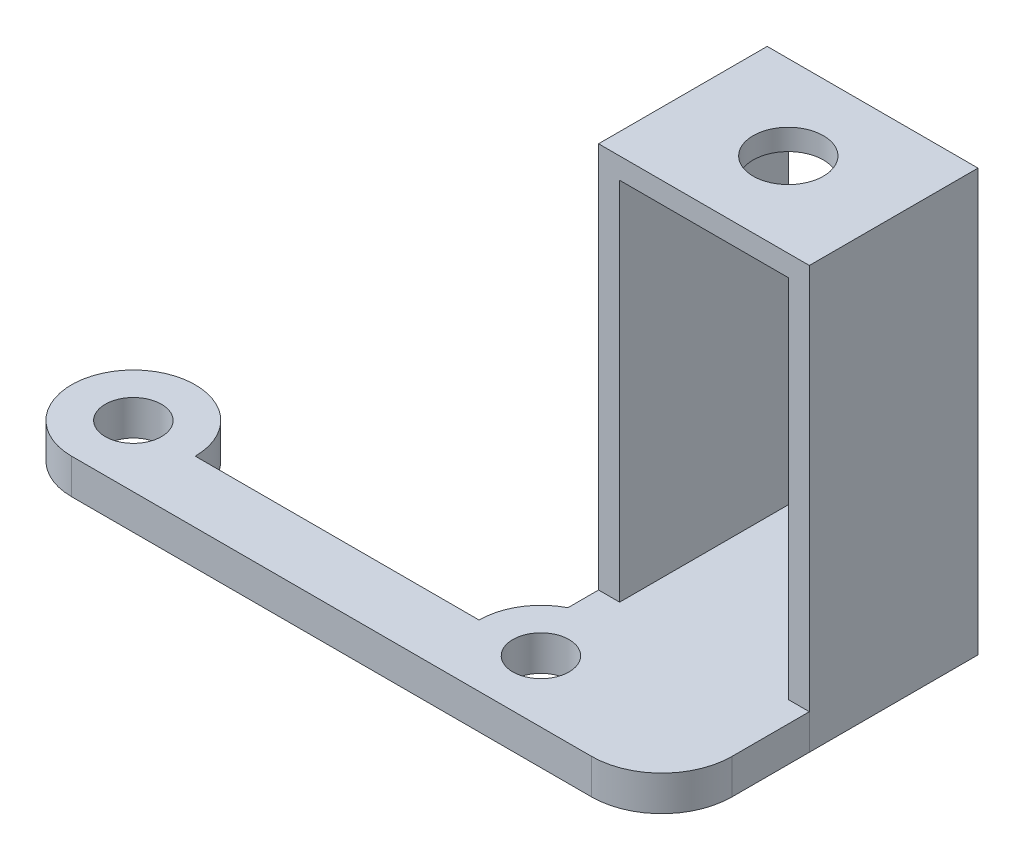
from build123d import *

# Parameters (mm, degrees)
SKETCH_1_R          = 4
EXTRUDE_1_DEPTH     = 5
EXTRUDE_2_DEPTH     = 5
EXTRUDE_3_DEPTH     = 24
SKETCH_6_R          = 5
CUT_EXTRUDE_1_DEPTH = 5
FILLET_1_R          = 10


with BuildPart() as part:
    # ｽｹｯﾁ1 → ﾎﾞｽ - 押し出し1 (new body)
    with BuildSketch(Plane(origin=(0, 0, 0), x_dir=(1, 0, 0), z_dir=(0, 1, 0))):
        with BuildLine():
            Line((-20.2, 0), (20.2, 0))
            ThreePointArc((20.2, 0), (35.222539674, 6.222539674), (29, -8.8))
            Line((29, -8.8), (-29, -8.8))
            ThreePointArc((-29, -8.8), (-35.222539674, 6.222539674), (-20.2, 0))
        make_face()
        with Locations(Location((-29, 0, 0), (0, 0, 270))):
            Circle(SKETCH_1_R, mode=Mode.SUBTRACT)
        with Locations(Location((29, 0, 0), (0, 0, 270))):
            Circle(SKETCH_1_R, mode=Mode.SUBTRACT)
    extrude(amount=EXTRUDE_1_DEPTH)

    # ｽｹｯﾁ2 → ﾎﾞｽ - 押し出し2 (add)
    with BuildSketch(Plane(origin=(0, 0, 0), x_dir=(1, 0, 0), z_dir=(0, 1, 0))):
        with BuildLine():
            ThreePointArc((25, 7.838367177), (37.556215026, 2.056984303), (29, -8.8))
            Line((29, -8.8), (55, -8.8))
            Line((55, -8.8), (55, 12.2))
            Line((55, 12.2), (52, 12.2))
            Line((52, 12.2), (52, 36.2))
            Line((52, 36.2), (28, 36.2))
            Line((28, 36.2), (28, 12.2))
            Line((28, 12.2), (25, 12.2))
            Line((25, 12.2), (25, 7.838367177))
        make_face()
    extrude(amount=EXTRUDE_2_DEPTH)

    # ﾌｨﾚｯﾄ1
    fillet_1_edges = [part.edges().sort_by_distance(p)[0] for p in [
        (55, 2.5, 8.8),
    ]]
    fillet(fillet_1_edges, radius=FILLET_1_R)


with BuildPart() as body_2:
    # ｽｹｯﾁ5 → ﾎﾞｽ - 押し出し3 (new body)
    with BuildSketch(Plane(origin=(0, 0, -12.2), x_dir=(-1, 0, 0), z_dir=(0, 0, -1))):
        Polygon((-55, 0), (-52, 0), (-52, 57), (-28, 57), (-28, 0), (-25, 0), (-25, 60), (-55, 60), align=None)
    extrude(amount=EXTRUDE_3_DEPTH)

    # ｽｹｯﾁ6 → ｶｯﾄ - 押し出し1 (cut)
    with BuildSketch(Plane.XZ.offset(-57)):
        with Locations(Location((40, -24.2, 0), (0, 0, 270))):
            Circle(SKETCH_6_R)
    extrude(amount=-CUT_EXTRUDE_1_DEPTH, mode=Mode.SUBTRACT)


solid = Compound([part.part, body_2.part])
